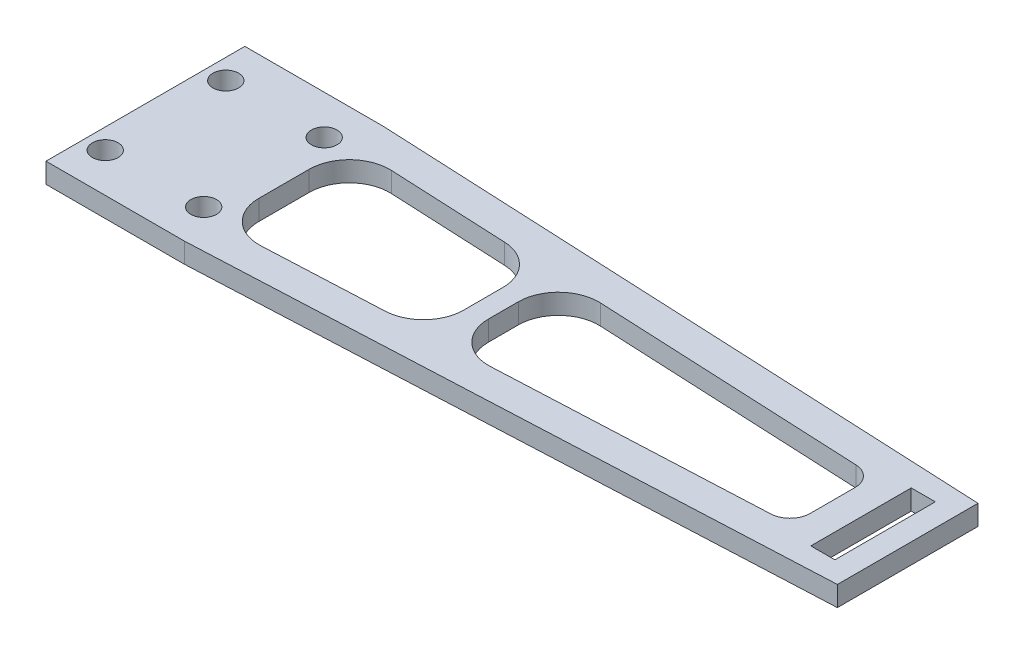
from build123d import *

# Parameters (mm, degrees)
SKETCH1_W           = 34.5
SKETCH1_H           = 49.5
BOSS_EXTRUDE1_DEPTH = 5
SKETCH2_R           = 3.2
CUT_EXTRUDE1_DEPTH  = 5
SKETCH3_W           = 6
SKETCH3_H           = 25
BOSS_EXTRUDE2_DEPTH = 5
FILLET1_R           = 10
FILLET2_R           = 5


with BuildPart() as part:
    # Sketch1 → Boss-Extrude1 (new body)
    with BuildSketch(Plane(origin=(0, 0, 0), x_dir=(1, 0, 0), z_dir=(0, 1, 0))):
        with Locations((17.25, 24.75)):
            Rectangle(SKETCH1_W, SKETCH1_H)
    extrude(amount=BOSS_EXTRUDE1_DEPTH)

    # Sketch2 → Cut-Extrude1 (cut)
    with BuildSketch(Plane(origin=(0, 5, 0), x_dir=(1, 0, 0), z_dir=(0, 1, 0))):
        with Locations(Location((5, 39.75, 0), (0, 0, 270))):
            Circle(SKETCH2_R)
        with Locations(Location((5, 9.75, 0), (0, 0, 90))):
            Circle(SKETCH2_R)
        with Locations(Location((29.5, 9.75, 0), (0, 0, 270))):
            Circle(SKETCH2_R)
        with Locations(Location((29.5, 39.75, 0), (0, 0, 90))):
            Circle(SKETCH2_R)
    extrude(amount=-CUT_EXTRUDE1_DEPTH, mode=Mode.SUBTRACT)

    # Sketch3 → Boss-Extrude2 (add)
    with BuildSketch(Plane(origin=(0, 5, 0), x_dir=(1, 0, 0), z_dir=(0, 1, 0))):
        Polygon((189.75, 42.25), (34.5, 49.5), (34.5, 41.491281612), (84.094915791, 39.175254948), (84.094915791, 10.324745052), (34.5, 8.008718388), (34.5, 0), (189.75, 7.25), align=None)
        Polygon((171.053500921, 14.385612956), (89.094915791, 10.558239416), (89.094915791, 38.941760584), (171.053500921, 35.114387044), align=None, mode=Mode.SUBTRACT)
        with Locations((181.13, 24.75)):
            Rectangle(SKETCH3_W, SKETCH3_H, mode=Mode.SUBTRACT)
    extrude(amount=-BOSS_EXTRUDE2_DEPTH)

    # Fillet1
    fillet1_edges = [part.edges().sort_by_distance(p)[0] for p in [
        (34.5, 2.5, -8.008718388),
        (84.094915791, 2.5, -10.324745052),
        (84.094915791, 2.5, -39.175254948),
        (34.5, 2.5, -41.491281612),
        (89.094915791, 2.5, -38.941760584),
        (89.094915791, 2.5, -10.558239416),
    ]]
    fillet(fillet1_edges, radius=FILLET1_R)

    # Fillet2
    fillet2_edges = [part.edges().sort_by_distance(p)[0] for p in [
        (171.053500921, 2.5, -35.114387044),
        (171.053500921, 2.5, -14.385612956),
    ]]
    fillet(fillet2_edges, radius=FILLET2_R)


solid = part.part
